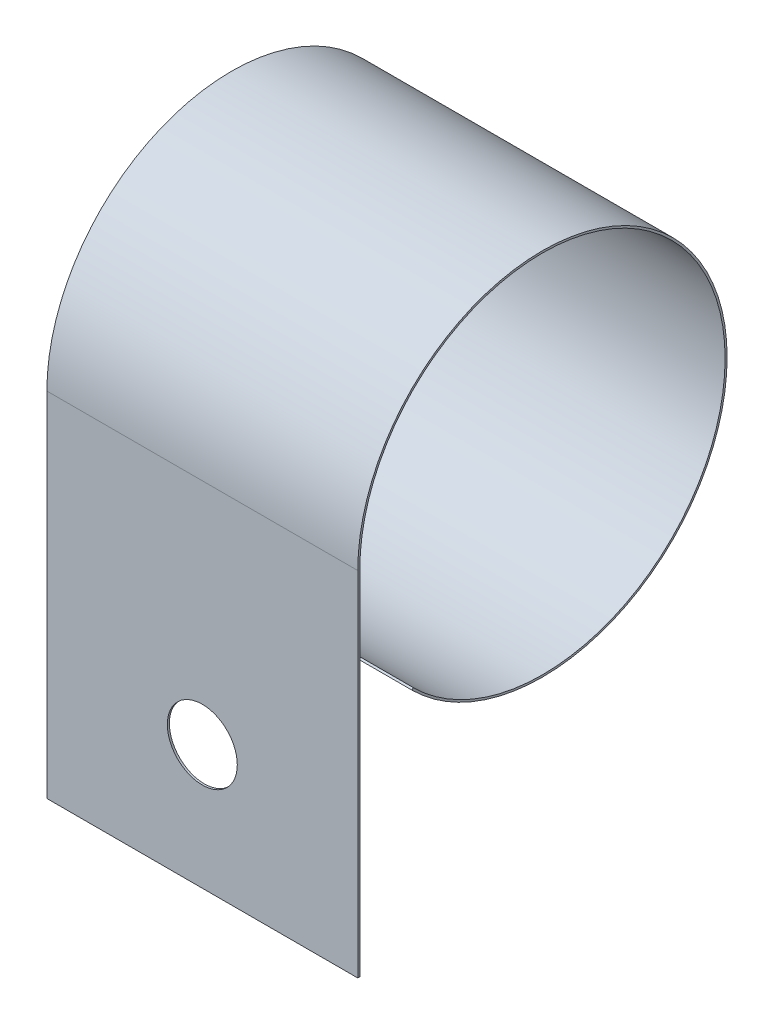
from build123d import *

# Parameters (mm, degrees)
BOSS_EXTRUDE1_DEPTH = 10
CUT_EXTRUDE1_REACH  = 36.349
SKETCH2_R           = 2.25


with BuildPart() as part:
    # Sketch1 → Boss-Extrude1 (new, symmetric)
    with BuildSketch(Plane(origin=(0, 0, 0), x_dir=(0, -1, 0), z_dir=(1, 0, 0))):
        with BuildLine():
            Line((8.40042856, -8.40042856), (8.308504679, -8.308504679))
            ThreePointArc((8.308504679, -8.308504679), (-4.49653033, 10.855584507), (0, -11.75))
            Line((0, -11.75), (22.7, -11.75))
            Line((22.7, -11.75), (22.7, -11.88))
            Line((22.7, -11.88), (0, -11.88))
            ThreePointArc((0, -11.88), (-4.546279176, 10.975688846), (8.40042856, -8.40042856))
        make_face()
    extrude(amount=BOSS_EXTRUDE1_DEPTH, both=True)

    # Sketch2 → Cut-Extrude1 (cut, up to next)
    with BuildSketch(Plane(origin=(0, 0, 11.88), x_dir=(-1, 0, 0), z_dir=(0, 0, -1)), mode=Mode.PRIVATE) as cut_extrude1_sk1:
        with Locations(Location((0, -14.7, 0), (0, 0, 180))):
            Circle(SKETCH2_R)
    cut_extrude1_tool1 = extrude(cut_extrude1_sk1.sketch, amount=CUT_EXTRUDE1_REACH, mode=Mode.PRIVATE) & part.part
    add(cut_extrude1_tool1.solids().sort_by_distance((0, -14.7, 11.88))[0], mode=Mode.SUBTRACT)


solid = part.part
